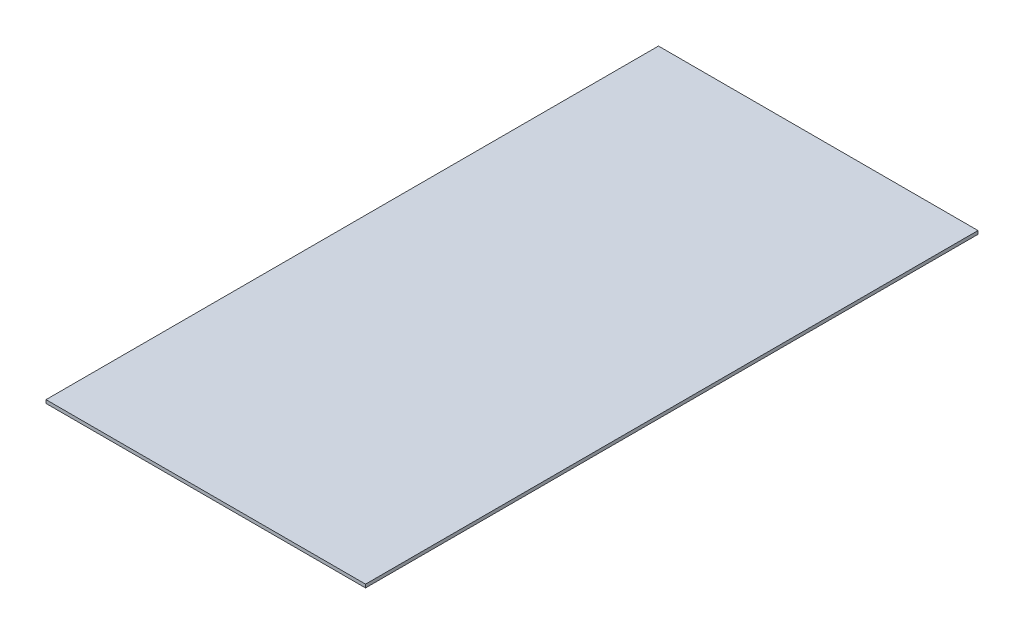
from build123d import *

# Parameters (mm, degrees)
SKETCH1_W           = 304.8
SKETCH1_H           = 584.2
BOSS_EXTRUDE1_DEPTH = 1.5875


with BuildPart() as part:
    # Sketch1 → Boss-Extrude1 (new, symmetric)
    with BuildSketch(Plane(origin=(0, 0, 0), x_dir=(1, 0, 0), z_dir=(0, 1, 0))):
        Rectangle(SKETCH1_W, SKETCH1_H)
    extrude(amount=BOSS_EXTRUDE1_DEPTH, both=True)


solid = part.part
